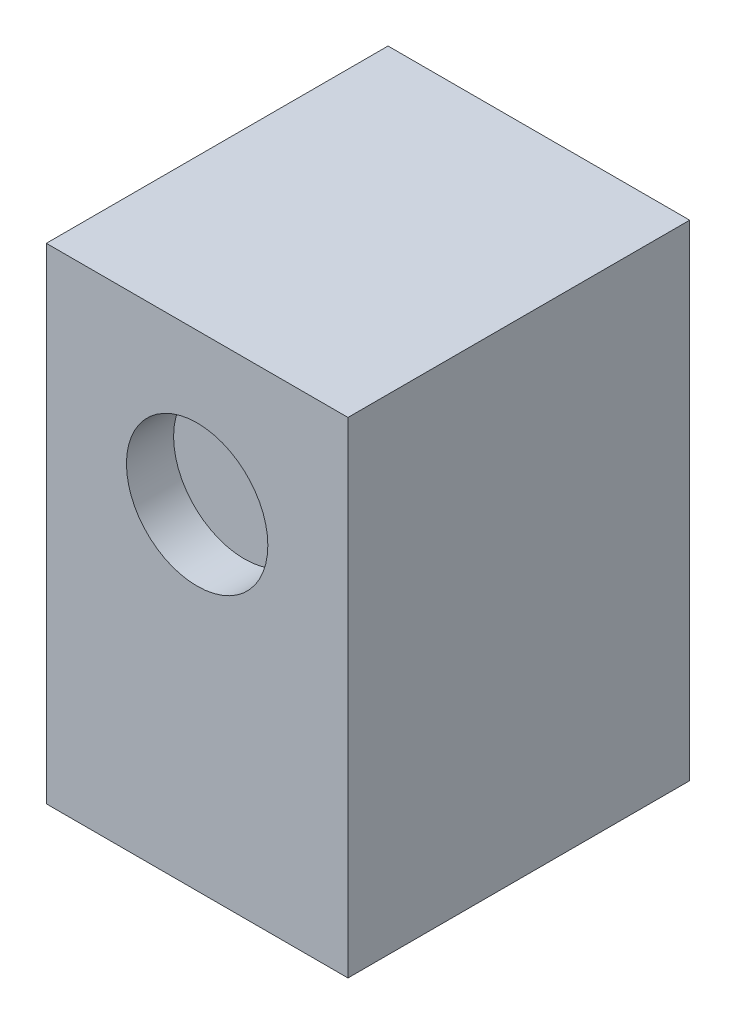
from build123d import *

# Parameters (mm, degrees)
SKETCH1_W           = 64
SKETCH1_H           = 72.5
BOSS_EXTRUDE1_DEPTH = 103
SKETCH2_R           = 15
CUT_EXTRUDE1_DEPTH  = 10
SKETCH3_R           = 15
CUT_EXTRUDE2_DEPTH  = 10


with BuildPart() as part:
    # Sketch1 → Boss-Extrude1 (new body)
    with BuildSketch(Plane(origin=(0, 0, 0), x_dir=(1, 0, 0), z_dir=(0, 1, 0))):
        Rectangle(SKETCH1_W, SKETCH1_H)
    extrude(amount=BOSS_EXTRUDE1_DEPTH)

    # Sketch2 → Cut-Extrude1 (cut)
    with BuildSketch(Plane.XY.offset(36.25)):
        with Locations((0, 71)):
            Circle(SKETCH2_R)
    extrude(amount=-CUT_EXTRUDE1_DEPTH, mode=Mode.SUBTRACT)

    # Sketch3 → Cut-Extrude2 (cut)
    with BuildSketch(Plane.XZ):
        with Locations(Location((0, 0, 0), (0, 0, 270))):
            Circle(SKETCH3_R)
    extrude(amount=-CUT_EXTRUDE2_DEPTH, mode=Mode.SUBTRACT)


solid = part.part
